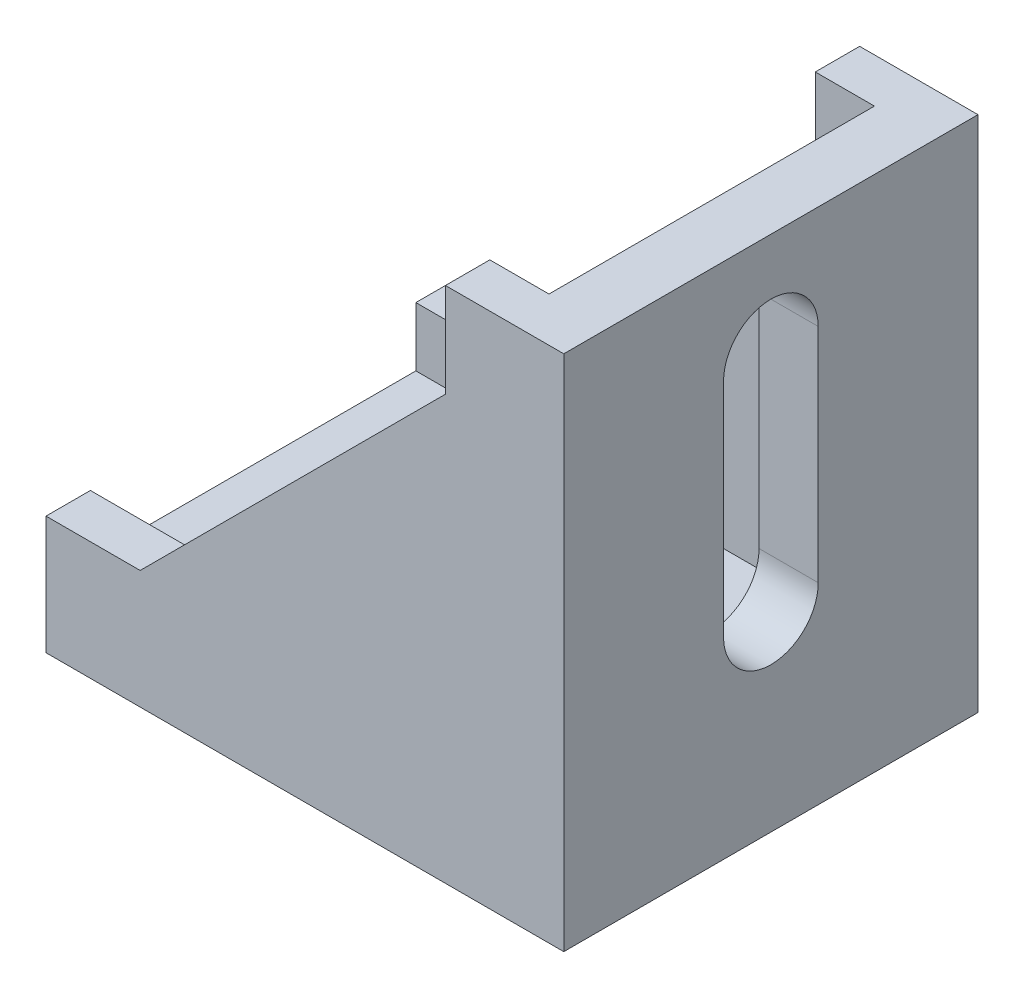
from build123d import *

# Parameters (mm, degrees)
SKETCH1_W               = 35
SKETCH1_H               = 28
BOSS_EXTRUDE1_DEPTH     = 35
SKETCH2_W               = 33.80681128
SKETCH2_H               = 22
CUT_EXTRUDE1_DEPTH      = 31
CUT_EXTRUDE2_DEPTH      = 49.117044797
CUT_EXTRUDE2_DEPTH_BACK = 49.117044797
CUT_EXTRUDE3_REACH      = 40.252
CUT_EXTRUDE4_REACH      = 43.343


with BuildPart() as part:
    # Sketch1 → Boss-Extrude1 (new body)
    with BuildSketch(Plane(origin=(0, 0, 0), x_dir=(1, 0, 0), z_dir=(0, 1, 0))):
        Rectangle(SKETCH1_W, SKETCH1_H)
    extrude(amount=BOSS_EXTRUDE1_DEPTH)

    # Sketch2 → Cut-Extrude1 (cut)
    with BuildSketch(Plane(origin=(0, 35, 0), x_dir=(1, 0, 0), z_dir=(0, 1, 0))):
        with Locations((-3.40340564, 0)):
            Rectangle(SKETCH2_W, SKETCH2_H)
    extrude(amount=-CUT_EXTRUDE1_DEPTH, mode=Mode.SUBTRACT)

    # Sketch3 → Cut-Extrude2 (cut, two sides: drawn at the far end of the back side and taken through both)
    with BuildSketch(Plane.XY.offset(14).offset(-CUT_EXTRUDE2_DEPTH_BACK)):
        Polygon((9.5, 133.408144421), (9.5, 35), (9.5, 28.634736483), (-11.134736483, 8), (-17.5, 8), (-115.908144421, 8), (-255.07827691, 147.170132488), (-129.670132488, 272.57827691), align=None)
    extrude(amount=CUT_EXTRUDE2_DEPTH + CUT_EXTRUDE2_DEPTH_BACK, mode=Mode.SUBTRACT)

    # Sketch4 → Cut-Extrude3 (cut, up to next)
    with BuildSketch(Plane(origin=(0, 4, 0), x_dir=(1, 0, 0), z_dir=(0, 1, 0)), mode=Mode.PRIVATE) as cut_extrude3_sk1:
        with BuildLine():
            Line((4.5, -3.2), (-10.5, -3.2))
            ThreePointArc((-10.5, -3.2), (-13.7, 0), (-10.5, 3.2))
            Line((-10.5, 3.2), (4.5, 3.2))
            ThreePointArc((4.5, 3.2), (7.7, 0), (4.5, -3.2))
        make_face()
    cut_extrude3_tool1 = extrude(cut_extrude3_sk1.sketch, amount=-CUT_EXTRUDE3_REACH, mode=Mode.PRIVATE) & part.part
    add(cut_extrude3_tool1.solids().sort_by_distance((-3, 4, 0))[0], mode=Mode.SUBTRACT)

    # Sketch5 → Cut-Extrude4 (cut, up to next)
    with BuildSketch(Plane(origin=(13.5, 23.5, 0), x_dir=(0, 1, 0), z_dir=(-1, 0, 0)), mode=Mode.PRIVATE) as cut_extrude4_sk1:
        with BuildLine():
            Line((4.5, -3.2), (-10.5, -3.2))
            ThreePointArc((-10.5, -3.2), (-13.7, 0), (-10.5, 3.2))
            Line((-10.5, 3.2), (4.5, 3.2))
            ThreePointArc((4.5, 3.2), (7.7, 0), (4.5, -3.2))
        make_face()
    cut_extrude4_tool1 = extrude(cut_extrude4_sk1.sketch, amount=-CUT_EXTRUDE4_REACH, mode=Mode.PRIVATE) & part.part
    add(cut_extrude4_tool1.solids().sort_by_distance((13.5, 20.5, 0))[0], mode=Mode.SUBTRACT)


solid = part.part
